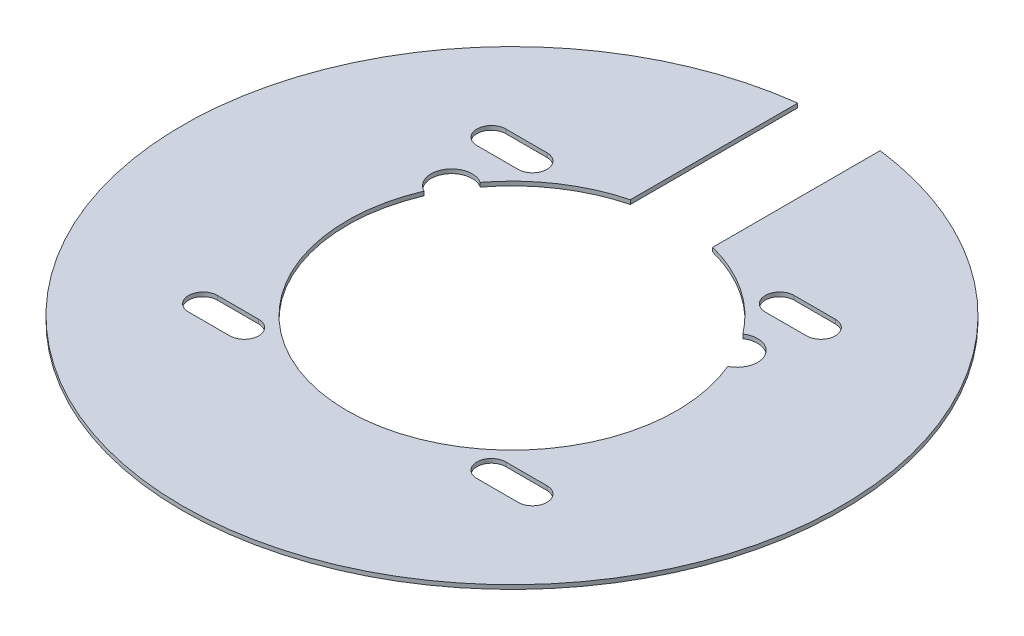
from build123d import *

# Parameters (mm, degrees)
EXTRUDE_1_DEPTH     = 1
CUT_EXTRUDE_1_DEPTH = 1
SKETCH_4_R          = 5
CUT_EXTRUDE_2_DEPTH = 1


with BuildPart() as part:
    # 草图1 → 凸台-拉伸1 (new body)
    with BuildSketch(Plane(origin=(0, 0, 0), x_dir=(1, 0, 0), z_dir=(0, 1, 0))):
        with BuildLine():
            Line((-10, 79.372539332), (-10, 38.729833462))
            ThreePointArc((-10, 38.729833462), (0, -40), (10, 38.729833462))
            Line((10, 38.729833462), (10, 79.372539332))
            ThreePointArc((10, 79.372539332), (0, -80), (-10, 79.372539332))
        make_face()
    extrude(amount=EXTRUDE_1_DEPTH)

    # 草图2 → 切除-拉伸1 (cut)
    with BuildSketch(Plane(origin=(0, 1, 0), x_dir=(1, 0, 0), z_dir=(0, 1, 0))):
        with BuildLine():
            Line((-40, 38.5), (-30, 38.5))
            ThreePointArc((-30, 38.5), (-26.5, 35), (-30, 31.5))
            Line((-30, 31.5), (-40, 31.5))
            ThreePointArc((-40, 31.5), (-43.5, 35), (-40, 38.5))
        make_face()
        with BuildLine():
            Line((30, 38.5), (40, 38.5))
            ThreePointArc((40, 38.5), (43.5, 35), (40, 31.5))
            Line((40, 31.5), (30, 31.5))
            ThreePointArc((30, 31.5), (26.5, 35), (30, 38.5))
        make_face()
        with BuildLine():
            Line((30, -31.5), (40, -31.5))
            ThreePointArc((40, -31.5), (43.5, -35), (40, -38.5))
            Line((40, -38.5), (30, -38.5))
            ThreePointArc((30, -38.5), (26.5, -35), (30, -31.5))
        make_face()
        with BuildLine():
            Line((-40, -31.5), (-30, -31.5))
            ThreePointArc((-30, -31.5), (-26.5, -35), (-30, -38.5))
            Line((-30, -38.5), (-40, -38.5))
            ThreePointArc((-40, -38.5), (-43.5, -35), (-40, -31.5))
        make_face()
    extrude(amount=-CUT_EXTRUDE_1_DEPTH, mode=Mode.SUBTRACT)

    # 草图4 → 切除-拉伸2 (cut)
    with BuildSketch(Plane(origin=(0, 1, 0), x_dir=(1, 0, 0), z_dir=(0, 1, 0))):
        with Locations((34.641016151, 20)):
            Circle(SKETCH_4_R)
        with Locations((-34.641016151, 20)):
            Circle(SKETCH_4_R)
    extrude(amount=-CUT_EXTRUDE_2_DEPTH, mode=Mode.SUBTRACT)


solid = part.part
